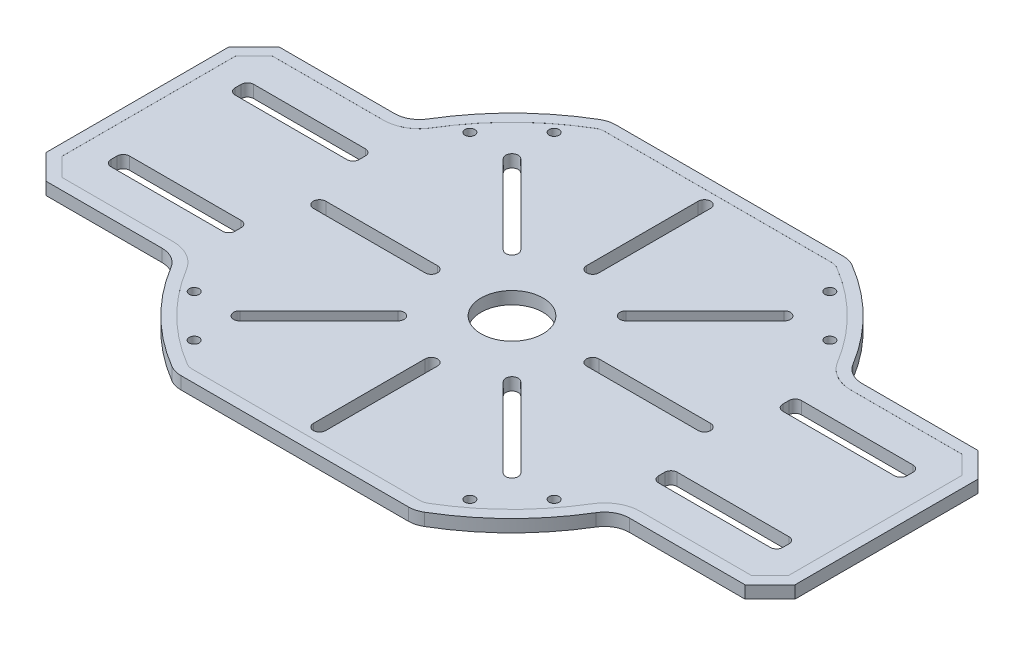
from build123d import *

# Parameters (mm, degrees)
SKETCH1_R           = 6.35
SKETCH1_R_2         = 1.016
SKETCH1_R_3         = 0.080960088
BOSS_EXTRUDE1_DEPTH = 2.54
CUT_EXTRUDE1_DEPTH  = 2.54
CUT_EXTRUDE2_DEPTH  = 2.54
BOSS_EXTRUDE2_DEPTH = 0.01


with BuildPart() as part:
    # Sketch1 → Boss-Extrude1 (new body)
    with BuildSketch(Plane(origin=(0, 0, 0), x_dir=(1, 0, 0), z_dir=(0, 1, 0))):
        with BuildLine():
            Line((-23.244816627, 44.45), (23.244816627, 44.45))
            ThreePointArc((23.244816627, 44.45), (24.583514169, 44.270437622), (25.827574029, 43.744444444))
            ThreePointArc((25.827574029, 43.744444444), (35.740062311, 36.101079569), (43.482663438, 26.265909091))
            ThreePointArc((43.482663438, 26.265909091), (45.334600658, 24.468164919), (47.830929781, 23.8125))
            Line((47.830929781, 23.8125), (71.516875, 23.8125))
            Line((71.516875, 23.8125), (76.596875, 18.7325))
            Line((76.596875, 18.7325), (76.596875, -18.7325))
            Line((76.596875, -18.7325), (71.516875, -23.8125))
            Line((71.516875, -23.8125), (47.830929781, -23.8125))
            ThreePointArc((47.830929781, -23.8125), (45.334600658, -24.468164919), (43.482663438, -26.265909091))
            ThreePointArc((43.482663438, -26.265909091), (35.740062311, -36.101079569), (25.827574029, -43.744444444))
            ThreePointArc((25.827574029, -43.744444444), (24.583514169, -44.270437622), (23.244816627, -44.45))
            Line((23.244816627, -44.45), (-23.244816627, -44.45))
            ThreePointArc((-23.244816627, -44.45), (-24.583514169, -44.270437622), (-25.827574029, -43.744444444))
            ThreePointArc((-25.827574029, -43.744444444), (-35.740062311, -36.101079569), (-43.482663438, -26.265909091))
            ThreePointArc((-43.482663438, -26.265909091), (-45.334600658, -24.468164919), (-47.830929781, -23.8125))
            Line((-47.830929781, -23.8125), (-71.516875, -23.8125))
            Line((-71.516875, -23.8125), (-76.596875, -18.7325))
            Line((-76.596875, -18.7325), (-76.596875, 18.7325))
            Line((-76.596875, 18.7325), (-71.516875, 23.8125))
            Line((-71.516875, 23.8125), (-47.830929781, 23.8125))
            ThreePointArc((-47.830929781, 23.8125), (-45.334600658, 24.468164919), (-43.482663438, 26.265909091))
            ThreePointArc((-43.482663438, 26.265909091), (-35.740062311, 36.101079569), (-25.827574029, 43.744444444))
            ThreePointArc((-25.827574029, 43.744444444), (-24.583514169, 44.270437622), (-23.244816627, 44.45))
        make_face()
        with Locations(Location((0, 0, 0), (0, 0, 270))):
            Circle(SKETCH1_R, mode=Mode.SUBTRACT)
        with Locations(Location((36.819050096, 28.19800422, 0), (0, 0, 270))):
            Circle(SKETCH1_R_2, mode=Mode.SUBTRACT)
        with Locations(Location((28.19800422, 36.819050096, 0), (0, 0, 90))):
            Circle(SKETCH1_R_2, mode=Mode.SUBTRACT)
        with Locations(Location((26.671582547, 26.671582547, 0), (0, 0, 270))):
            Circle(SKETCH1_R_3, mode=Mode.SUBTRACT)
        with Locations(Location((26.671582547, -26.671582547, 0), (0, 0, 270))):
            Circle(SKETCH1_R_3, mode=Mode.SUBTRACT)
        with Locations(Location((36.819050096, -28.19800422, 0), (0, 0, 90))):
            Circle(SKETCH1_R_2, mode=Mode.SUBTRACT)
        with Locations(Location((28.19800422, -36.819050096, 0), (0, 0, 270))):
            Circle(SKETCH1_R_2, mode=Mode.SUBTRACT)
        with Locations(Location((-26.671582547, -26.671582547, 0), (0, 0, 270))):
            Circle(SKETCH1_R_3, mode=Mode.SUBTRACT)
        with Locations(Location((-28.19800422, -36.819050096, 0), (0, 0, 90))):
            Circle(SKETCH1_R_2, mode=Mode.SUBTRACT)
        with Locations(Location((-36.819050096, -28.19800422, 0), (0, 0, 270))):
            Circle(SKETCH1_R_2, mode=Mode.SUBTRACT)
        with Locations(Location((-26.671582547, 26.671582547, 0), (0, 0, 270))):
            Circle(SKETCH1_R_3, mode=Mode.SUBTRACT)
        with Locations(Location((-36.819050096, 28.19800422, 0), (0, 0, 90))):
            Circle(SKETCH1_R_2, mode=Mode.SUBTRACT)
        with Locations(Location((-28.19800422, 36.819050096, 0), (0, 0, 270))):
            Circle(SKETCH1_R_2, mode=Mode.SUBTRACT)
    extrude(amount=BOSS_EXTRUDE1_DEPTH)

    # Sketch3 → Cut-Extrude1 (cut)
    with BuildSketch(Plane(origin=(0, 2.54, 0), x_dir=(1, 0, 0), z_dir=(0, 1, 0))):
        with BuildLine():
            Line((10.776307345, 12.572358569), (26.940768363, 28.736819587))
            ThreePointArc((26.940768363, 28.736819587), (28.736819587, 28.736819587), (28.736819587, 26.940768363))
            Line((28.736819587, 26.940768363), (12.572358569, 10.776307345))
            ThreePointArc((12.572358569, 10.776307345), (10.776307345, 10.776307345), (10.776307345, 12.572358569))
        make_face()
        with BuildLine():
            Line((16.51, -1.27), (39.37, -1.27))
            ThreePointArc((39.37, -1.27), (40.64, 0), (39.37, 1.27))
            Line((39.37, 1.27), (16.51, 1.27))
            ThreePointArc((16.51, 1.27), (15.24, 0), (16.51, -1.27))
        make_face()
        with BuildLine():
            Line((10.776307345, -12.572358569), (26.940768363, -28.736819587))
            ThreePointArc((26.940768363, -28.736819587), (28.736819587, -28.736819587), (28.736819587, -26.940768363))
            Line((28.736819587, -26.940768363), (12.572358569, -10.776307345))
            ThreePointArc((12.572358569, -10.776307345), (10.776307345, -10.776307345), (10.776307345, -12.572358569))
        make_face()
        with BuildLine():
            Line((-1.27, -16.51), (-1.27, -39.37))
            ThreePointArc((-1.27, -39.37), (0, -40.64), (1.27, -39.37))
            Line((1.27, -39.37), (1.27, -16.51))
            ThreePointArc((1.27, -16.51), (0, -15.24), (-1.27, -16.51))
        make_face()
        with BuildLine():
            Line((-12.572358569, -10.776307345), (-28.736819587, -26.940768363))
            ThreePointArc((-28.736819587, -26.940768363), (-28.736819587, -28.736819587), (-26.940768363, -28.736819587))
            Line((-26.940768363, -28.736819587), (-10.776307345, -12.572358569))
            ThreePointArc((-10.776307345, -12.572358569), (-10.776307345, -10.776307345), (-12.572358569, -10.776307345))
        make_face()
        with BuildLine():
            Line((-16.51, 1.27), (-39.37, 1.27))
            ThreePointArc((-39.37, 1.27), (-40.64, 0), (-39.37, -1.27))
            Line((-39.37, -1.27), (-16.51, -1.27))
            ThreePointArc((-16.51, -1.27), (-15.24, 0), (-16.51, 1.27))
        make_face()
        with BuildLine():
            Line((-10.776307345, 12.572358569), (-26.940768363, 28.736819587))
            ThreePointArc((-26.940768363, 28.736819587), (-28.736819587, 28.736819587), (-28.736819587, 26.940768363))
            Line((-28.736819587, 26.940768363), (-12.572358569, 10.776307345))
            ThreePointArc((-12.572358569, 10.776307345), (-10.776307345, 10.776307345), (-10.776307345, 12.572358569))
        make_face()
        with BuildLine():
            Line((1.27, 16.51), (1.27, 39.37))
            ThreePointArc((1.27, 39.37), (0, 40.64), (-1.27, 39.37))
            Line((-1.27, 39.37), (-1.27, 16.51))
            ThreePointArc((-1.27, 16.51), (0, 15.24), (1.27, 16.51))
        make_face()
    extrude(amount=-CUT_EXTRUDE1_DEPTH, mode=Mode.SUBTRACT)

    # Sketch4 → Cut-Extrude2 (cut)
    with BuildSketch(Plane(origin=(0, 2.54, 0), x_dir=(1, 0, 0), z_dir=(0, 1, 0))):
        with BuildLine():
            Line((44.592875, 14.605), (67.452875, 14.605))
            ThreePointArc((67.452875, 14.605), (68.350900612, 14.233025612), (68.722875, 13.335))
            Line((68.722875, 13.335), (68.722875, 12.065))
            ThreePointArc((68.722875, 12.065), (68.350900612, 11.166974388), (67.452875, 10.795))
            Line((67.452875, 10.795), (44.592875, 10.795))
            ThreePointArc((44.592875, 10.795), (43.694849388, 11.166974388), (43.322875, 12.065))
            Line((43.322875, 12.065), (43.322875, 13.335))
            ThreePointArc((43.322875, 13.335), (43.694849388, 14.233025612), (44.592875, 14.605))
        make_face()
        with BuildLine():
            Line((68.722875, -13.335), (68.722875, -12.065))
            ThreePointArc((68.722875, -12.065), (68.350900612, -11.166974388), (67.452875, -10.795))
            Line((67.452875, -10.795), (44.592875, -10.795))
            ThreePointArc((44.592875, -10.795), (43.694849388, -11.166974388), (43.322875, -12.065))
            Line((43.322875, -12.065), (43.322875, -13.335))
            ThreePointArc((43.322875, -13.335), (43.694849388, -14.233025612), (44.592875, -14.605))
            Line((44.592875, -14.605), (67.452875, -14.605))
            ThreePointArc((67.452875, -14.605), (68.350900612, -14.233025612), (68.722875, -13.335))
        make_face()
        with BuildLine():
            Line((-44.592875, -14.605), (-67.452875, -14.605))
            ThreePointArc((-67.452875, -14.605), (-68.350900612, -14.233025612), (-68.722875, -13.335))
            Line((-68.722875, -13.335), (-68.722875, -12.065))
            ThreePointArc((-68.722875, -12.065), (-68.350900612, -11.166974388), (-67.452875, -10.795))
            Line((-67.452875, -10.795), (-44.592875, -10.795))
            ThreePointArc((-44.592875, -10.795), (-43.694849388, -11.166974388), (-43.322875, -12.065))
            Line((-43.322875, -12.065), (-43.322875, -13.335))
            ThreePointArc((-43.322875, -13.335), (-43.694849388, -14.233025612), (-44.592875, -14.605))
        make_face()
        with BuildLine():
            Line((-68.722875, 13.335), (-68.722875, 12.065))
            ThreePointArc((-68.722875, 12.065), (-68.350900612, 11.166974388), (-67.452875, 10.795))
            Line((-67.452875, 10.795), (-44.592875, 10.795))
            ThreePointArc((-44.592875, 10.795), (-43.694849388, 11.166974388), (-43.322875, 12.065))
            Line((-43.322875, 12.065), (-43.322875, 13.335))
            ThreePointArc((-43.322875, 13.335), (-43.694849388, 14.233025612), (-44.592875, 14.605))
            Line((-44.592875, 14.605), (-67.452875, 14.605))
            ThreePointArc((-67.452875, 14.605), (-68.350900612, 14.233025612), (-68.722875, 13.335))
        make_face()
    extrude(amount=-CUT_EXTRUDE2_DEPTH, mode=Mode.SUBTRACT)

    # Sketch8 → Boss-Extrude2 (add)
    with BuildSketch(Plane(origin=(0, 2.54, 0), x_dir=(1, 0, 0), z_dir=(0, 1, 0))):
        with BuildLine():
            Line((47.830929781, -23.8125), (71.516875, -23.8125))
            Line((71.516875, -23.8125), (76.596875, -18.7325))
            Line((76.596875, -18.7325), (76.596875, 18.7325))
            Line((76.596875, 18.7325), (71.516875, 23.8125))
            Line((71.516875, 23.8125), (47.830929781, 23.8125))
            ThreePointArc((47.830929781, 23.8125), (45.334600658, 24.468164919), (43.482663438, 26.265909091))
            ThreePointArc((43.482663438, 26.265909091), (35.740062311, 36.101079569), (25.827574029, 43.744444444))
            ThreePointArc((25.827574029, 43.744444444), (24.583514169, 44.270437622), (23.244816627, 44.45))
            Line((23.244816627, 44.45), (-23.244816627, 44.45))
            ThreePointArc((-23.244816627, 44.45), (-24.583514169, 44.270437622), (-25.827574029, 43.744444444))
            ThreePointArc((-25.827574029, 43.744444444), (-35.740062311, 36.101079569), (-43.482663438, 26.265909091))
            ThreePointArc((-43.482663438, 26.265909091), (-45.334600658, 24.468164919), (-47.830929781, 23.8125))
            Line((-47.830929781, 23.8125), (-71.516875, 23.8125))
            Line((-71.516875, 23.8125), (-76.596875, 18.7325))
            Line((-76.596875, 18.7325), (-76.596875, -18.7325))
            Line((-76.596875, -18.7325), (-71.516875, -23.8125))
            Line((-71.516875, -23.8125), (-47.830929781, -23.8125))
            ThreePointArc((-47.830929781, -23.8125), (-45.334600658, -24.468164919), (-43.482663438, -26.265909091))
            ThreePointArc((-43.482663438, -26.265909091), (-35.740062311, -36.101079569), (-25.827574029, -43.744444444))
            ThreePointArc((-25.827574029, -43.744444444), (-24.583514169, -44.270437622), (-23.244816627, -44.45))
            Line((-23.244816627, -44.45), (23.244816627, -44.45))
            ThreePointArc((23.244816627, -44.45), (24.583514169, -44.270437622), (25.827574029, -43.744444444))
            ThreePointArc((25.827574029, -43.744444444), (35.740062311, -36.101079569), (43.482663438, -26.265909091))
            ThreePointArc((43.482663438, -26.265909091), (45.334600658, -24.468164919), (47.830929781, -23.8125))
        make_face()
        with BuildLine():
            Line((47.830929781, -21.5125), (70.564183807, -21.5125))
            Line((70.564183807, -21.5125), (74.296875, -17.779808807))
            Line((74.296875, -17.779808807), (74.296875, 17.779808807))
            Line((74.296875, 17.779808807), (70.564183807, 21.5125))
            Line((70.564183807, 21.5125), (47.830929781, 21.5125))
            ThreePointArc((47.830929781, 21.5125), (44.204372906, 22.465021083), (41.513960172, 25.076704545))
            ThreePointArc((41.513960172, 25.076704545), (34.121909883, 34.466581872), (24.658215363, 41.763888889))
            ThreePointArc((24.658215363, 41.763888889), (23.977410951, 42.051735549), (23.244816627, 42.15))
            Line((23.244816627, 42.15), (-23.244816627, 42.15))
            ThreePointArc((-23.244816627, 42.15), (-23.977410951, 42.051735549), (-24.658215363, 41.763888889))
            ThreePointArc((-24.658215363, 41.763888889), (-34.121909883, 34.466581872), (-41.513960172, 25.076704545))
            ThreePointArc((-41.513960172, 25.076704545), (-44.204372906, 22.465021083), (-47.830929781, 21.5125))
            Line((-47.830929781, 21.5125), (-70.564183807, 21.5125))
            Line((-70.564183807, 21.5125), (-74.296875, 17.779808807))
            Line((-74.296875, 17.779808807), (-74.296875, -17.779808807))
            Line((-74.296875, -17.779808807), (-70.564183807, -21.5125))
            Line((-70.564183807, -21.5125), (-47.830929781, -21.5125))
            ThreePointArc((-47.830929781, -21.5125), (-44.204372906, -22.465021083), (-41.513960172, -25.076704545))
            ThreePointArc((-41.513960172, -25.076704545), (-34.121909883, -34.466581872), (-24.658215363, -41.763888889))
            ThreePointArc((-24.658215363, -41.763888889), (-23.977410951, -42.051735549), (-23.244816627, -42.15))
            Line((-23.244816627, -42.15), (23.244816627, -42.15))
            ThreePointArc((23.244816627, -42.15), (23.977410951, -42.051735549), (24.658215363, -41.763888889))
            ThreePointArc((24.658215363, -41.763888889), (34.121909883, -34.466581872), (41.513960172, -25.076704545))
            ThreePointArc((41.513960172, -25.076704545), (44.204372906, -22.465021083), (47.830929781, -21.5125))
        make_face(mode=Mode.SUBTRACT)
    extrude(amount=BOSS_EXTRUDE2_DEPTH)


solid = part.part
